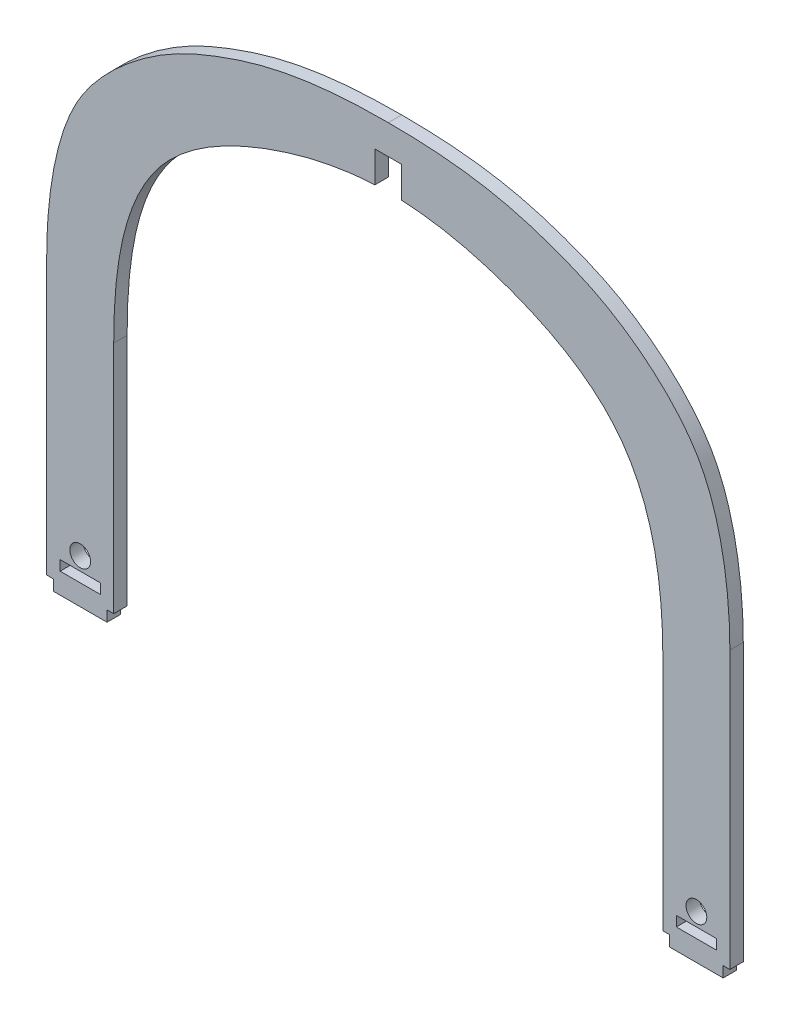
from build123d import *

# Parameters (mm, degrees)
EXTRUDE_591_DEPTH      = 2
SKETCH_661_W           = 4
SKETCH_661_H           = 6.6
CUT_EXTRUDE_1012_DEPTH = 133.151428436
SKETCH_1060_R          = 1.55
CUT_EXTRUDE_1420_DEPTH = 133.151428436
SKETCH_4_W             = 6
SKETCH_4_H             = 1.5
CUT_EXTRUDE_1982_DEPTH = 133.151428436


with BuildPart() as part:
    # 草图1 → Extrude 591 (new body)
    with BuildSketch(Plane.XY):
        with BuildLine():
            Line((0, 0), (1, 0))
            Line((1, 0), (1, -1.6))
            Line((1, -1.6), (9, -1.6))
            Line((9, -1.6), (9, 0))
            Line((9, 0), (10, 0))
            Line((10, 0), (10, 35))
            add(Edge.make_bspline(
                [(10, 35), (10, 45.958933229), (12.802105927, 61.850376918), (33.138971404, 72.605774334), (45.150309794, 75), (51, 75)],
                knots=[0, 0, 0, 0, 0.44110143, 0.721666216, 1, 1, 1, 1], degree=3))
            add(Edge.make_bspline(
                [(92, 35), (92, 45.958933229), (89.197894073, 61.850376918), (68.861028596, 72.605774334), (56.849690206, 75), (51, 75)],
                knots=[0, 0, 0, 0, 0.44110143, 0.721666216, 1, 1, 1, 1], degree=3))
            Line((92, 35), (92, 0))
            Line((92, 0), (93, 0))
            Line((93, 0), (93, -1.6))
            Line((93, -1.6), (101, -1.6))
            Line((101, -1.6), (101, 0))
            Line((101, 0), (102, 0))
            Line((102, 0), (102, 41.318702341))
            add(Edge.make_bspline(
                [(102, 41.318702341), (102, 48.39057612), (100.674869512, 58.830698863), (93.328102077, 69.833438872), (85.60235792, 76.079385067), (71.260445241, 82.051607308), (62.638712904, 84), (51, 84)],
                knots=[0, 0, 0, 0, 0.315306946, 0.38075993, 0.62411096, 0.689076855, 1, 1, 1, 1], degree=3))
            add(Edge.make_bspline(
                [(0, 41.318702341), (0, 48.39057612), (1.325130488, 58.830698863), (8.671897923, 69.833438872), (16.39764208, 76.079385067), (30.739554759, 82.051607308), (39.361287096, 84), (51, 84)],
                knots=[0, 0, 0, 0, 0.315306946, 0.38075993, 0.62411096, 0.689076855, 1, 1, 1, 1], degree=3))
            Line((0, 41.318702341), (0, 0))
        make_face()
    extrude(amount=EXTRUDE_591_DEPTH)

    # Sketch 661 → Cut-Extrude 1012 (cut, through all)
    with BuildSketch(Plane(origin=(0, 0, 0), x_dir=(-1, 0, 0), z_dir=(0, 0, -1))):
        with Locations((-51, 76.3)):
            Rectangle(SKETCH_661_W, SKETCH_661_H)
    extrude(amount=-CUT_EXTRUDE_1012_DEPTH, mode=Mode.SUBTRACT)

    # Sketch 1060 → Cut-Extrude 1420 (cut, through all)
    with BuildSketch(Plane(origin=(0, 0, 0), x_dir=(-1, 0, 0), z_dir=(0, 0, -1))):
        with Locations((-97, 5)):
            Circle(SKETCH_1060_R)
        with Locations(Location((-5, 5, 0), (0, 0, 180))):
            Circle(SKETCH_1060_R)
    extrude(amount=-CUT_EXTRUDE_1420_DEPTH, mode=Mode.SUBTRACT)

    # 草图4 → Cut-Extrude 1982 (cut, through all)
    with BuildSketch(Plane(origin=(0, 0, 0), x_dir=(-1, 0, 0), z_dir=(0, 0, -1))):
        with Locations((-97, 2.25)):
            Rectangle(SKETCH_4_W, SKETCH_4_H)
        with Locations((-5, 2.25)):
            Rectangle(SKETCH_4_W, SKETCH_4_H)
    extrude(amount=-CUT_EXTRUDE_1982_DEPTH, mode=Mode.SUBTRACT)


solid = part.part
